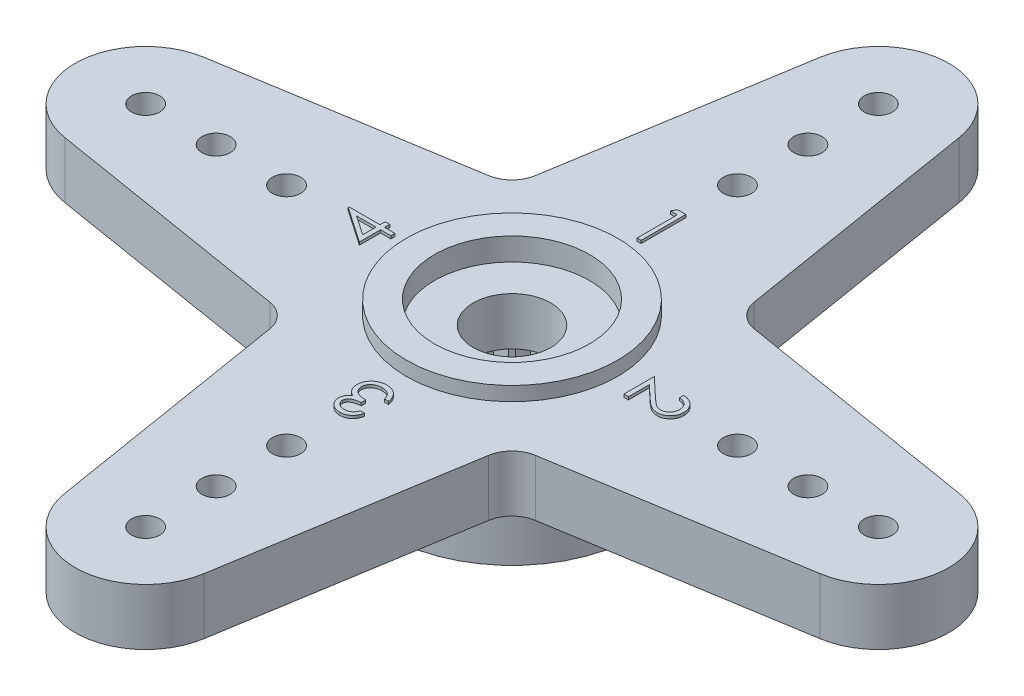
from build123d import *

# Parameters (mm, degrees)
SKETCH1_R           = 0.5
SKETCH1_R_2         = 1.375
BOSS_EXTRUDE1_DEPTH = 2
SKETCH2_R           = 3.75
SKETCH2_R_2         = 2.75
BOSS_EXTRUDE2_DEPTH = 0.5
CUT_EXTRUDE1_START  = -0.8
SKETCH3_R           = 2.75
SKETCH3_R_2         = 1.375
CUT_EXTRUDE1_DEPTH  = 0.8
SKETCH4_R           = 4.5
SKETCH4_R_2         = 2.5
BOSS_EXTRUDE3_DEPTH = 2.5
CUT_EXTRUDE3_START  = -2.5
CUT_EXTRUDE3_DEPTH  = 2.5
BOSS_EXTRUDE4_DEPTH = 0.1
FILLET1_R           = 1


with BuildPart() as part:
    # Sketch1 → Boss-Extrude1 (new body)
    with BuildSketch(Plane(origin=(0, 0, 0), x_dir=(1, 0, 0), z_dir=(0, 1, 0))):
        with BuildLine():
            Line((-4, 4), (-2.467435953, 13.402193757))
            ThreePointArc((-2.467435953, 13.402193757), (0, 15.5), (2.467435953, 13.402193757))
            Line((2.467435953, 13.402193757), (4, 4))
            Line((4, 4), (13.402193757, 2.467435953))
            ThreePointArc((13.402193757, 2.467435953), (15.5, 0), (13.402193757, -2.467435953))
            Line((13.402193757, -2.467435953), (4, -4))
            Line((4, -4), (2.467435953, -13.402193757))
            ThreePointArc((2.467435953, -13.402193757), (0, -15.5), (-2.467435953, -13.402193757))
            Line((-2.467435953, -13.402193757), (-4, -4))
            Line((-4, -4), (-13.402193757, -2.467435953))
            ThreePointArc((-13.402193757, -2.467435953), (-15.5, 0), (-13.402193757, 2.467435953))
            Line((-13.402193757, 2.467435953), (-4, 4))
        make_face()
        with Locations(Location((13, 0, 0), (0, 0, 270))):
            Circle(SKETCH1_R, mode=Mode.SUBTRACT)
        with Locations(Location((10.5, 0, 0), (0, 0, 270))):
            Circle(SKETCH1_R, mode=Mode.SUBTRACT)
        with Locations(Location((8, 0, 0), (0, 0, 270))):
            Circle(SKETCH1_R, mode=Mode.SUBTRACT)
        with Locations(Location((0, 13, 0), (0, 0, 270))):
            Circle(SKETCH1_R, mode=Mode.SUBTRACT)
        with Locations(Location((0, 10.5, 0), (0, 0, 270))):
            Circle(SKETCH1_R, mode=Mode.SUBTRACT)
        with Locations(Location((0, 8, 0), (0, 0, 270))):
            Circle(SKETCH1_R, mode=Mode.SUBTRACT)
        with Locations(Location((0, -13, 0), (0, 0, 270))):
            Circle(SKETCH1_R, mode=Mode.SUBTRACT)
        with Locations(Location((0, -10.5, 0), (0, 0, 270))):
            Circle(SKETCH1_R, mode=Mode.SUBTRACT)
        with Locations(Location((0, -8, 0), (0, 0, 270))):
            Circle(SKETCH1_R, mode=Mode.SUBTRACT)
        with Locations(Location((-13, 0, 0), (0, 0, 270))):
            Circle(SKETCH1_R, mode=Mode.SUBTRACT)
        with Locations(Location((-10.5, 0, 0), (0, 0, 270))):
            Circle(SKETCH1_R, mode=Mode.SUBTRACT)
        with Locations(Location((-8, 0, 0), (0, 0, 270))):
            Circle(SKETCH1_R, mode=Mode.SUBTRACT)
        with Locations(Location((0, 0, 0), (0, 0, 270))):
            Circle(SKETCH1_R_2, mode=Mode.SUBTRACT)
    extrude(amount=BOSS_EXTRUDE1_DEPTH)

    # Sketch2 → Boss-Extrude2 (add)
    with BuildSketch(Plane(origin=(0, 2, 0), x_dir=(1, 0, 0), z_dir=(0, 1, 0))):
        with Locations(Location((0, 0, 0), (0, 0, 270))):
            Circle(SKETCH2_R)
        with Locations(Location((0, 0, 0), (0, 0, 270))):
            Circle(SKETCH2_R_2, mode=Mode.SUBTRACT)
    extrude(amount=BOSS_EXTRUDE2_DEPTH)

    # Sketch3 → Cut-Extrude1 (cut)
    with BuildSketch(Plane(origin=(0, 2.5, 0), x_dir=(1, 0, 0), z_dir=(0, 1, 0)).offset(CUT_EXTRUDE1_START)):
        with Locations(Location((0, 0, 0), (0, 0, 270))):
            Circle(SKETCH3_R)
        with Locations(Location((0, 0, 0), (0, 0, 270))):
            Circle(SKETCH3_R_2, mode=Mode.SUBTRACT)
    extrude(amount=CUT_EXTRUDE1_DEPTH, mode=Mode.SUBTRACT)

    # Sketch4 → Boss-Extrude3 (add)
    with BuildSketch(Plane.XZ):
        with Locations(Location((0, 0, 0), (0, 0, 90))):
            Circle(SKETCH4_R)
        with Locations(Location((0, 0, 0), (0, 0, 270))):
            Circle(SKETCH4_R_2, mode=Mode.SUBTRACT)
    extrude(amount=BOSS_EXTRUDE3_DEPTH)

    # Sketch5 → Cut-Extrude3 (cut)
    with BuildSketch(Plane.XZ.offset(2.5).offset(CUT_EXTRUDE3_START)):
        with BuildLine():
            Line((0.299038106, 2.482050808), (0, 3))
            Line((0, 3), (-0.299038106, 2.482050808))
            ThreePointArc((-0.299038106, 2.482050808), (-0.391086163, 2.469220851), (-0.482593741, 2.452978451))
            Line((-0.482593741, 2.452978451), (-0.927050983, 2.853169549))
            Line((-0.927050983, 2.853169549), (-1.051398019, 2.268162738))
            ThreePointArc((-1.051398019, 2.268162738), (-1.134976249, 2.22751631), (-1.216985951, 2.183791473))
            Line((-1.216985951, 2.183791473), (-1.763355757, 2.427050983))
            Line((-1.763355757, 2.427050983), (-1.70083977, 1.832251096))
            ThreePointArc((-1.70083977, 1.832251096), (-1.767766953, 1.767766953), (-1.832251096, 1.70083977))
            Line((-1.832251096, 1.70083977), (-2.427050983, 1.763355757))
            Line((-2.427050983, 1.763355757), (-2.183791473, 1.216985951))
            ThreePointArc((-2.183791473, 1.216985951), (-2.22751631, 1.134976249), (-2.268162738, 1.051398019))
            Line((-2.268162738, 1.051398019), (-2.853169549, 0.927050983))
            Line((-2.853169549, 0.927050983), (-2.452978451, 0.482593741))
            ThreePointArc((-2.452978451, 0.482593741), (-2.469220851, 0.391086163), (-2.482050808, 0.299038106))
            Line((-2.482050808, 0.299038106), (-3, 0))
            Line((-3, 0), (-2.482050808, -0.299038106))
            ThreePointArc((-2.482050808, -0.299038106), (-2.469220851, -0.391086163), (-2.452978451, -0.482593741))
            Line((-2.452978451, -0.482593741), (-2.853169549, -0.927050983))
            Line((-2.853169549, -0.927050983), (-2.268162738, -1.051398019))
            ThreePointArc((-2.268162738, -1.051398019), (-2.22751631, -1.134976249), (-2.183791473, -1.216985951))
            Line((-2.183791473, -1.216985951), (-2.427050983, -1.763355757))
            Line((-2.427050983, -1.763355757), (-1.832251096, -1.70083977))
            ThreePointArc((-1.832251096, -1.70083977), (-1.767766953, -1.767766953), (-1.70083977, -1.832251096))
            Line((-1.70083977, -1.832251096), (-1.763355757, -2.427050983))
            Line((-1.763355757, -2.427050983), (-1.216985951, -2.183791473))
            ThreePointArc((-1.216985951, -2.183791473), (-1.134976249, -2.22751631), (-1.051398019, -2.268162738))
            Line((-1.051398019, -2.268162738), (-0.927050983, -2.853169549))
            Line((-0.927050983, -2.853169549), (-0.482593741, -2.452978451))
            ThreePointArc((-0.482593741, -2.452978451), (-0.391086163, -2.469220851), (-0.299038106, -2.482050808))
            Line((-0.299038106, -2.482050808), (0, -3))
            Line((0, -3), (0.299038106, -2.482050808))
            ThreePointArc((0.299038106, -2.482050808), (0.391086163, -2.469220851), (0.482593741, -2.452978451))
            Line((0.482593741, -2.452978451), (0.927050983, -2.853169549))
            Line((0.927050983, -2.853169549), (1.051398019, -2.268162738))
            ThreePointArc((1.051398019, -2.268162738), (1.134976249, -2.22751631), (1.216985951, -2.183791473))
            Line((1.216985951, -2.183791473), (1.763355757, -2.427050983))
            Line((1.763355757, -2.427050983), (1.70083977, -1.832251096))
            ThreePointArc((1.70083977, -1.832251096), (1.767766953, -1.767766953), (1.832251096, -1.70083977))
            Line((1.832251096, -1.70083977), (2.427050983, -1.763355757))
            Line((2.427050983, -1.763355757), (2.183791473, -1.216985951))
            ThreePointArc((2.183791473, -1.216985951), (2.22751631, -1.134976249), (2.268162738, -1.051398019))
            Line((2.268162738, -1.051398019), (2.853169549, -0.927050983))
            Line((2.853169549, -0.927050983), (2.452978451, -0.482593741))
            ThreePointArc((2.452978451, -0.482593741), (2.469220851, -0.391086163), (2.482050808, -0.299038106))
            Line((2.482050808, -0.299038106), (3, 0))
            Line((3, 0), (2.482050808, 0.299038106))
            ThreePointArc((2.482050808, 0.299038106), (2.469220851, 0.391086163), (2.452978451, 0.482593741))
            Line((2.452978451, 0.482593741), (2.853169549, 0.927050983))
            Line((2.853169549, 0.927050983), (2.268162738, 1.051398019))
            ThreePointArc((2.268162738, 1.051398019), (2.22751631, 1.134976249), (2.183791473, 1.216985951))
            Line((2.183791473, 1.216985951), (2.427050983, 1.763355757))
            Line((2.427050983, 1.763355757), (1.832251096, 1.70083977))
            ThreePointArc((1.832251096, 1.70083977), (1.767766953, 1.767766953), (1.70083977, 1.832251096))
            Line((1.70083977, 1.832251096), (1.763355757, 2.427050983))
            Line((1.763355757, 2.427050983), (1.216985951, 2.183791473))
            ThreePointArc((1.216985951, 2.183791473), (1.134976249, 2.22751631), (1.051398019, 2.268162738))
            Line((1.051398019, 2.268162738), (0.927050983, 2.853169549))
            Line((0.927050983, 2.853169549), (0.482593741, 2.452978451))
            ThreePointArc((0.482593741, 2.452978451), (0.391086163, 2.469220851), (0.299038106, 2.482050808))
        make_face()
    extrude(amount=CUT_EXTRUDE3_DEPTH, mode=Mode.SUBTRACT)

    # Sketch6 → Boss-Extrude4 (add)
    # profile 1 of 4: a face of its own
    with BuildSketch(Plane(origin=(0, 2, 0), x_dir=(1, 0, 0), z_dir=(0, 1, 0))):
        Polygon((-0.212111879, 6.0875), (0.081410256, 6.0875), (0.081410256, 4.5), (-0.061057692, 4.5), (-0.061057692, 5.924679487), (-0.305288462, 5.924679487), align=None)
    # profile 2 of 4: a face of its own
    with BuildSketch(Plane(origin=(0, 2, 0), x_dir=(1, 0, 0), z_dir=(0, 1, 0))):
        with BuildLine():
            Line((5.599038462, 0.34599359), (5.599038462, 0.488461538))
            add(Edge.make_bspline(
                [(5.599038462, 0.488461538), (5.617939279, 0.487533166), (5.655059981, 0.485709868), (5.709180577, 0.477167658), (5.760917347, 0.46495614), (5.809826741, 0.447649569), (5.856493025, 0.426277468), (5.900296523, 0.40011183), (5.941671981, 0.369710466), (5.979836023, 0.335129148), (6.014722729, 0.29760523), (6.045167992, 0.25736354), (6.070596953, 0.214817686), (6.091970581, 0.170336692), (6.107994605, 0.123406123), (6.119889389, 0.074474582), (6.127044708, 0.023320904), (6.12781392, -0.011531495), (6.128205128, -0.029256811)],
                knots=[0, 0, 0, 0, 1.100776268, 2.161895295, 3.184016182, 4.190939212, 5.176500551, 6.166955529, 7.155448256, 8.160289653, 9.16017456, 10.133824356, 11.091467644, 12.04088621, 13.000931625, 13.972173743, 14.968683325, 16, 16, 16, 16], degree=3))
            add(Edge.make_bspline(
                [(6.128205128, -0.029256811), (6.127797614, -0.046664009), (6.126996863, -0.080868531), (6.120120254, -0.130789516), (6.109349932, -0.178313503), (6.094239011, -0.223347597), (6.073926074, -0.265532491), (6.049525047, -0.305185086), (6.02130391, -0.342777454), (5.988078073, -0.376616959), (5.952607706, -0.407690267), (5.914739978, -0.434497361), (5.875628838, -0.457454046), (5.834976046, -0.476589172), (5.79239883, -0.490675349), (5.748517063, -0.501369751), (5.702876523, -0.507414685), (5.671985336, -0.50834243), (5.656280048, -0.508814103)],
                knots=[0, 0, 0, 0, 1.111607364, 2.184268762, 3.212621178, 4.221274766, 5.211760367, 6.196651075, 7.1921475, 8.207485113, 9.220403448, 10.201281604, 11.166441695, 12.114753415, 13.065576456, 14.026450734, 14.996634279, 16, 16, 16, 16], degree=3))
            add(Edge.make_bspline(
                [(5.656280048, -0.508814103), (5.634169423, -0.508046087), (5.590336183, -0.506523533), (5.525922299, -0.493499512), (5.463513856, -0.473158416), (5.413286579, -0.448666758), (5.372812816, -0.423959614), (5.339489511, -0.401694923), (5.30360953, -0.375630526), (5.265293024, -0.345387065), (5.224239863, -0.311590155), (5.180474849, -0.273933674), (5.134450153, -0.232149094), (5.103015113, -0.202821846), (5.086726262, -0.1876252)],
                knots=[0, 0, 0, 0, 1.184426356, 2.348067706, 3.509069118, 4.696110526, 5.333549288, 6.050745305, 6.844228056, 7.710549037, 8.667450064, 9.695053472, 10.805634456, 12, 12, 12, 12], degree=3))
            Line((5.086726262, -0.1876252), (4.662820513, 0.209567808))
            Line((4.662820513, 0.209567808), (4.662820513, -0.529166667))
            Line((4.662820513, -0.529166667), (4.5, -0.529166667))
            Line((4.5, -0.529166667), (4.5, 0.549519231))
            Line((4.5, 0.549519231), (5.15700621, -0.066145833))
            add(Edge.make_bspline(
                [(5.15700621, -0.066145833), (5.172652803, -0.081136472), (5.202706705, -0.10993042), (5.246597776, -0.15063927), (5.287268318, -0.187261175), (5.324898551, -0.219820431), (5.359275147, -0.248343825), (5.390667508, -0.272740096), (5.418806234, -0.293117072), (5.451862432, -0.31471242), (5.492269991, -0.335305017), (5.541401752, -0.353403803), (5.592090897, -0.364360562), (5.626334746, -0.36568164), (5.643559696, -0.366346154)],
                knots=[0, 0, 0, 0, 1.329530082, 2.553755191, 3.672934919, 4.687409497, 5.60679272, 6.413407421, 7.126401618, 7.737995624, 8.834647426, 9.90044882, 10.943907757, 12, 12, 12, 12], degree=3))
            add(Edge.make_bspline(
                [(5.643559696, -0.366346154), (5.654392812, -0.366060761), (5.675742806, -0.365498307), (5.707024672, -0.360440353), (5.737316681, -0.353009214), (5.766244292, -0.341555532), (5.794376458, -0.327794356), (5.820857871, -0.310213439), (5.846591221, -0.290123068), (5.87069413, -0.266819222), (5.892776139, -0.241235929), (5.912335573, -0.214204803), (5.928681993, -0.185607306), (5.94208205, -0.155562618), (5.952593749, -0.124154868), (5.959877459, -0.091323211), (5.964450586, -0.057158391), (5.965069336, -0.033829626), (5.965384615, -0.021942608)],
                knots=[0, 0, 0, 0, 0.991504627, 1.954065223, 2.895985987, 3.842598665, 4.797835564, 5.759220273, 6.74786863, 7.784730864, 8.824135544, 9.839918996, 10.835834653, 11.835434876, 12.84861661, 13.863796685, 14.911511676, 16, 16, 16, 16], degree=3))
            add(Edge.make_bspline(
                [(5.965384615, -0.021942608), (5.965060395, -0.009527925), (5.964423681, 0.014852462), (5.959967009, 0.050647099), (5.952285925, 0.084797422), (5.941755322, 0.117372561), (5.928497209, 0.148403903), (5.911665037, 0.177610862), (5.891915995, 0.205260088), (5.869403165, 0.231300798), (5.844219896, 0.255228126), (5.816492727, 0.276692883), (5.786041295, 0.295000051), (5.753553406, 0.311228532), (5.718165248, 0.323645722), (5.680734357, 0.334259816), (5.64072893, 0.341970171), (5.613166096, 0.344630175), (5.599038462, 0.34599359)],
                knots=[0, 0, 0, 0, 1.031212865, 2.025131798, 2.990757446, 3.934781266, 4.865570067, 5.788494791, 6.729227313, 7.684356718, 8.643577152, 9.610526866, 10.590658432, 11.59095419, 12.621640561, 13.700587263, 14.82141059, 16, 16, 16, 16], degree=3))
        make_face()
    # profile 3 of 4: a face of its own
    with BuildSketch(Plane(origin=(0, 2, 0), x_dir=(1, 0, 0), z_dir=(0, 1, 0))):
        with BuildLine():
            Line((0.34599359, -5.721153846), (0.488461538, -5.721153846))
            add(Edge.make_bspline(
                [(0.488461538, -5.721153846), (0.484601849, -5.737134294), (0.477056473, -5.768374763), (0.461318645, -5.813009485), (0.444173983, -5.855247654), (0.423586782, -5.894298373), (0.401131025, -5.930946447), (0.37540322, -5.964360657), (0.347590345, -5.995390823), (0.316826886, -6.022928613), (0.284564958, -6.04786494), (0.250349969, -6.069126127), (0.2148703, -6.08741601), (0.177880129, -6.102483759), (0.139269329, -6.113834621), (0.099386965, -6.122070029), (0.05812852, -6.127418142), (0.030121577, -6.127940095), (0.015900441, -6.128205128)],
                knots=[0, 0, 0, 0, 1.162005537, 2.271625781, 3.343758855, 4.383309926, 5.390229558, 6.379919256, 7.361854164, 8.333198761, 9.295911338, 10.242430842, 11.177959212, 12.116337295, 13.062827104, 14.020064771, 14.994644689, 16, 16, 16, 16], degree=3))
            add(Edge.make_bspline(
                [(0.015900441, -6.128205128), (-0.004819946, -6.127579549), (-0.045808747, -6.126342036), (-0.106026272, -6.115041559), (-0.164095579, -6.097159445), (-0.21938106, -6.072451719), (-0.270733706, -6.041977474), (-0.316424762, -6.005707754), (-0.355834908, -5.964342356), (-0.388897715, -5.918652943), (-0.414785304, -5.86982348), (-0.43387448, -5.819567694), (-0.445495743, -5.7680048), (-0.447001853, -5.733189891), (-0.44775641, -5.715747696)],
                knots=[0, 0, 0, 0, 1.083050992, 2.142477498, 3.193116406, 4.255571735, 5.30263384, 6.308962982, 7.297363603, 8.282367274, 9.249857812, 10.179914175, 11.08814088, 12, 12, 12, 12], degree=3))
            add(Edge.make_bspline(
                [(-0.44775641, -5.715747696), (-0.447228639, -5.698962472), (-0.446195871, -5.666116392), (-0.437426655, -5.618164141), (-0.422669136, -5.572969558), (-0.402226779, -5.530342388), (-0.375764719, -5.490552907), (-0.343709603, -5.453511592), (-0.305835181, -5.419054153), (-0.277133663, -5.399314963), (-0.262357272, -5.389152644)],
                knots=[0, 0, 0, 0, 1.024540389, 2.004866551, 2.965041327, 3.920577974, 4.882998113, 5.874504559, 6.905732034, 8, 8, 8, 8], degree=3))
            add(Edge.make_bspline(
                [(-0.262357272, -5.389152644), (-0.279266057, -5.38102782), (-0.312821544, -5.364904106), (-0.358097689, -5.332780608), (-0.399825574, -5.296601576), (-0.422822908, -5.268052723), (-0.43440004, -5.253680889)],
                knots=[0, 0, 0, 0, 1.015663554, 2.015584519, 3.001021554, 4, 4, 4, 4], degree=3))
            add(Edge.make_bspline(
                [(-0.43440004, -5.253680889), (-0.442041901, -5.243223667), (-0.457200483, -5.222480465), (-0.475858316, -5.189110161), (-0.492978135, -5.155480456), (-0.505577827, -5.120269074), (-0.516450862, -5.084607067), (-0.523604956, -5.047730768), (-0.528197599, -5.009990535), (-0.5288425, -4.984446887), (-0.529166667, -4.971607071)],
                knots=[0, 0, 0, 0, 1.02516404, 2.033540309, 3.025129118, 4.011046665, 4.991655828, 5.976607087, 6.982917762, 8, 8, 8, 8], degree=3))
            add(Edge.make_bspline(
                [(-0.529166667, -4.971607071), (-0.528350817, -4.94937866), (-0.526722958, -4.905026444), (-0.512235463, -4.839481871), (-0.489636803, -4.775530087), (-0.458141824, -4.71407805), (-0.418998333, -4.656756936), (-0.372686258, -4.605322495), (-0.319156288, -4.561514187), (-0.259966982, -4.524586511), (-0.195593193, -4.495321744), (-0.127013944, -4.474234108), (-0.05463527, -4.461584484), (-0.005138768, -4.460066765), (0.020034555, -4.459294872)],
                knots=[0, 0, 0, 0, 0.955619592, 1.906742024, 2.874954321, 3.868585453, 4.869520953, 5.854611167, 6.836527075, 7.836578462, 8.849204403, 9.870874567, 10.917152508, 12, 12, 12, 12], degree=3))
            add(Edge.make_bspline(
                [(0.020034555, -4.459294872), (0.037005812, -4.459692103), (0.070399587, -4.460473722), (0.11951096, -4.465721886), (0.166290723, -4.475567824), (0.211193125, -4.487950453), (0.253540479, -4.505070826), (0.293941914, -4.525481482), (0.332220335, -4.549705826), (0.36814842, -4.577784596), (0.401687783, -4.60921458), (0.431983954, -4.644517919), (0.459372127, -4.683035728), (0.48367828, -4.725114484), (0.50500471, -4.770636328), (0.52289247, -4.819783675), (0.538510693, -4.872175513), (0.545786309, -4.908676289), (0.549519231, -4.927403846)],
                knots=[0, 0, 0, 0, 1.048603596, 2.063302207, 3.045874044, 3.999447474, 4.937100059, 5.862643889, 6.7929026, 7.7308982, 8.676022965, 9.627908155, 10.600123445, 11.591992905, 12.626222643, 13.701663232, 14.820785756, 16, 16, 16, 16], degree=3))
            Line((0.549519231, -4.927403846), (0.407051282, -4.927403846))
            add(Edge.make_bspline(
                [(0.407051282, -4.927403846), (0.403339575, -4.915180544), (0.396119982, -4.891405159), (0.383830783, -4.857187592), (0.369829816, -4.825819475), (0.354809999, -4.797070701), (0.339035489, -4.770658147), (0.321384791, -4.747280228), (0.303165214, -4.725910119), (0.289431365, -4.713870241), (0.282709836, -4.707977764)],
                knots=[0, 0, 0, 0, 1.198163088, 2.33053128, 3.407730985, 4.417276592, 5.372219308, 6.28897303, 7.162600585, 8, 8, 8, 8], degree=3))
            add(Edge.make_bspline(
                [(0.282709836, -4.707977764), (0.273820396, -4.701127882), (0.256068955, -4.68744926), (0.227160407, -4.669943613), (0.196651098, -4.654959198), (0.164286602, -4.642779237), (0.130062577, -4.63363652), (0.094117851, -4.627056022), (0.056393446, -4.622711871), (0.030647277, -4.622317113), (0.017490485, -4.622115385)],
                knots=[0, 0, 0, 0, 0.946083416, 1.889246487, 2.84504177, 3.809995578, 4.801312957, 5.829064617, 6.89060985, 8, 8, 8, 8], degree=3))
            add(Edge.make_bspline(
                [(0.017490485, -4.622115385), (0.002634231, -4.622394287), (-0.026415892, -4.622939657), (-0.068801536, -4.627969629), (-0.109137453, -4.635263244), (-0.147012014, -4.646671877), (-0.182940598, -4.660358417), (-0.216121178, -4.678276609), (-0.247529219, -4.69851231), (-0.276244612, -4.722050322), (-0.302132943, -4.747492366), (-0.324503322, -4.774484107), (-0.343878628, -4.802188626), (-0.35945314, -4.831252213), (-0.371773311, -4.861389777), (-0.380155306, -4.892714125), (-0.385984774, -4.924961484), (-0.386459435, -4.946882168), (-0.386698718, -4.957932692)],
                knots=[0, 0, 0, 0, 1.216990249, 2.379719373, 3.493992396, 4.571561497, 5.616923107, 6.638958652, 7.655775068, 8.674704564, 9.676001865, 10.625896028, 11.54399481, 12.441854662, 13.322657739, 14.20572845, 15.095482574, 16, 16, 16, 16], degree=3))
            add(Edge.make_bspline(
                [(-0.386698718, -4.957932692), (-0.386003169, -4.972723335), (-0.384615531, -5.002231023), (-0.374065118, -5.0456597), (-0.356555994, -5.087519235), (-0.332520572, -5.127261442), (-0.302560837, -5.163663871), (-0.268092983, -5.196247969), (-0.228381575, -5.223379244), (-0.191624295, -5.242072337), (-0.158981256, -5.254526807), (-0.131102444, -5.263260269), (-0.099863368, -5.270241472), (-0.06563939, -5.276994458), (-0.028286064, -5.282655717), (0.012230232, -5.287397248), (0.055925805, -5.291185256), (0.086174952, -5.292877803), (0.101762821, -5.29375)],
                knots=[0, 0, 0, 0, 1.070440979, 2.135555593, 3.216243406, 4.345886539, 5.486149072, 6.621334998, 7.769144672, 8.957074012, 9.598644492, 10.297969361, 11.070758978, 11.915404831, 12.824182859, 13.805940418, 14.869366021, 16, 16, 16, 16], degree=3))
            Line((0.101762821, -5.29375), (0.101762821, -5.456570513))
            add(Edge.make_bspline(
                [(0.101762821, -5.456570513), (0.082130288, -5.456953283), (0.043688426, -5.457702772), (-0.012623157, -5.464900992), (-0.066305692, -5.47658472), (-0.116551716, -5.492896722), (-0.162112282, -5.512755295), (-0.202016873, -5.53498931), (-0.234829912, -5.560639777), (-0.261139083, -5.588494162), (-0.280652882, -5.618558339), (-0.295056815, -5.64975068), (-0.303576438, -5.682651469), (-0.304715777, -5.70510004), (-0.305288462, -5.716383714)],
                knots=[0, 0, 0, 0, 1.321816535, 2.58820849, 3.816448615, 5.017641336, 6.139869627, 7.160068286, 8.085608132, 8.934319198, 9.728416342, 10.48890201, 11.240453369, 12, 12, 12, 12], degree=3))
            add(Edge.make_bspline(
                [(-0.305288462, -5.716383714), (-0.305104632, -5.724675376), (-0.304738912, -5.741171245), (-0.299942506, -5.765346601), (-0.293068021, -5.788783239), (-0.283080788, -5.811207319), (-0.270164259, -5.832690124), (-0.254537181, -5.853310117), (-0.236159971, -5.8732642), (-0.215151965, -5.892112288), (-0.191706493, -5.9090759), (-0.166764563, -5.924198724), (-0.140228938, -5.936914866), (-0.112272542, -5.947455684), (-0.082744259, -5.95537096), (-0.051799429, -5.961057912), (-0.019374439, -5.964612556), (0.002746995, -5.965124413), (0.013992388, -5.965384615)],
                knots=[0, 0, 0, 0, 0.884246871, 1.759167212, 2.622361933, 3.489113179, 4.372562419, 5.294145153, 6.247651513, 7.265905295, 8.30305477, 9.334068495, 10.37719476, 11.441246459, 12.52060732, 13.637552802, 14.799054011, 16, 16, 16, 16], degree=3))
            add(Edge.make_bspline(
                [(0.013992388, -5.965384615), (0.032068563, -5.964754757), (0.067375538, -5.963524498), (0.118264696, -5.952711076), (0.16552422, -5.935578323), (0.201526445, -5.914890575), (0.228156868, -5.894539373), (0.24755157, -5.877031234), (0.266250048, -5.85718059), (0.283518559, -5.83444296), (0.300391868, -5.809600201), (0.31670886, -5.782515486), (0.331945433, -5.752802669), (0.341220184, -5.73190776), (0.34599359, -5.721153846)],
                knots=[0, 0, 0, 0, 1.4727372, 2.876598283, 4.222346151, 5.558423782, 6.24313385, 6.953189256, 7.68715613, 8.463578749, 9.278833271, 10.135787152, 11.040551781, 12, 12, 12, 12], degree=3))
        make_face()
    # profile 4 of 4: a face of its own
    with BuildSketch(Plane(origin=(0, 2, 0), x_dir=(1, 0, 0), z_dir=(0, 1, 0))):
        Polygon((-6.128205128, 0.317054788), (-6.128205128, 0.34599359), (-5.029166667, 0.34599359), (-5.029166667, 0.529166667), (-4.866346154, 0.529166667), (-4.866346154, 0.34599359), (-4.5, 0.34599359), (-4.5, 0.203525641), (-4.866346154, 0.203525641), (-4.866346154, -0.549519231), align=None)
        Polygon((-5.029166667, 0.203525641), (-5.718609776, 0.203525641), (-5.029166667, -0.269671474), align=None, mode=Mode.SUBTRACT)
    extrude(amount=BOSS_EXTRUDE4_DEPTH)

    # Fillet1
    fillet1_edges = [part.edges().sort_by_distance(p)[0] for p in [
        (-4, 1, -4),
        (4, 1, -4),
        (4, 1, 4),
        (-4, 1, 4),
    ]]
    fillet(fillet1_edges, radius=FILLET1_R)


solid = part.part
